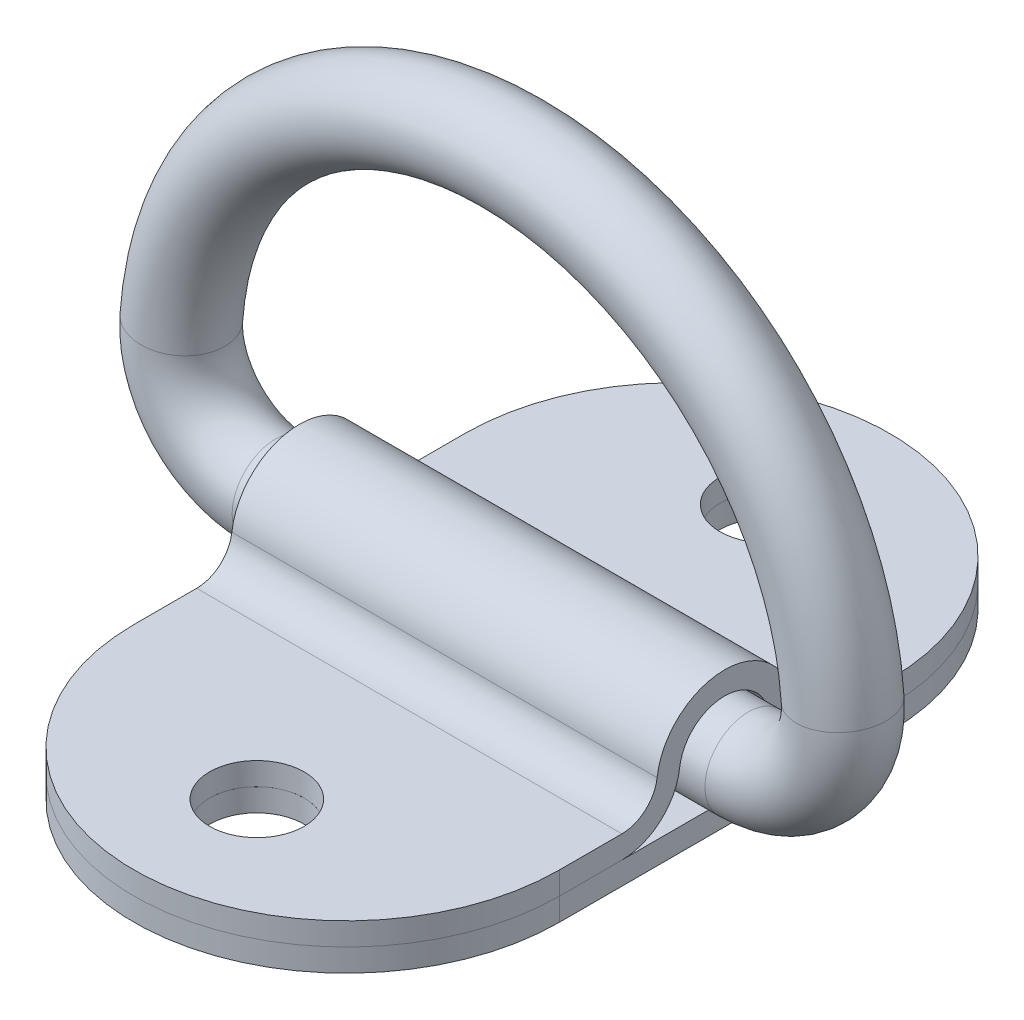
from build123d import *

# Parameters (mm, degrees)
BOSS_EXTRUDE1_DEPTH      = 14.2875
BOSS_EXTRUDE1_DEPTH_BACK = 14.2875
BOSS_EXTRUDE2_DEPTH      = 14.2875
BOSS_EXTRUDE2_DEPTH_BACK = 14.2875
SKETCH5_W                = 50.8
SKETCH5_H                = 1.524
SKETCH6_OUTSIDE_W        = 42.376
SKETCH6_OUTSIDE_H        = 64.6
CUT_EXTRUDE1_DEPTH       = 30.499082024
SKETCH7_R                = 3.175
CUT_EXTRUDE2_DEPTH       = 30.499082024
SKETCH8_R                = 2.921


with BuildPart() as part:
    # Sketch4 → Boss-Extrude1 (new, two sides: drawn at the far end of the back side and taken through both)
    with BuildSketch(Plane(origin=(0, 0, 0), x_dir=(0, 0, -1), z_dir=(1, 0, 0)).offset(-BOSS_EXTRUDE1_DEPTH_BACK)):
        with BuildLine():
            Line((-25.4, -3.048), (-6.900203475, -3.048))
            ThreePointArc((-6.900203475, -3.048), (-4.314597158, -2.069457627), (-3.024746729, 0.375780822))
            ThreePointArc((-3.024746729, 0.375780822), (0, 3.048), (3.024746729, 0.375780822))
            ThreePointArc((3.024746729, 0.375780822), (4.314597158, -2.069457627), (6.900203475, -3.048))
            Line((6.900203475, -3.048), (25.4, -3.048))
            Line((25.4, -3.048), (25.4, -1.524))
            Line((25.4, -1.524), (6.900203475, -1.524))
            ThreePointArc((6.900203475, -1.524), (5.323614257, -0.927327821), (4.537120093, 0.563671233))
            ThreePointArc((4.537120093, 0.563671233), (0, 4.572), (-4.537120093, 0.563671233))
            ThreePointArc((-4.537120093, 0.563671233), (-5.323614257, -0.927327821), (-6.900203475, -1.524))
            Line((-6.900203475, -1.524), (-25.4, -1.524))
            Line((-25.4, -1.524), (-25.4, -3.048))
        make_face()
    extrude(amount=BOSS_EXTRUDE1_DEPTH + BOSS_EXTRUDE1_DEPTH_BACK)


with BuildPart() as body_2:
    # Sketch5 → Boss-Extrude2 (new, two sides: drawn at the far end of the back side and taken through both)
    with BuildSketch(Plane(origin=(0, 0, 0), x_dir=(0, 0, -1), z_dir=(1, 0, 0)).offset(-BOSS_EXTRUDE2_DEPTH_BACK)):
        with Locations((0, -3.81)):
            Rectangle(SKETCH5_W, SKETCH5_H)
    extrude(amount=BOSS_EXTRUDE2_DEPTH + BOSS_EXTRUDE2_DEPTH_BACK)


with BuildPart() as cut_extrude1_tool:
    # Sketch6 outside → Cut-Extrude1 (new, through all)
    with BuildSketch(Plane(origin=(0, 0, 0), x_dir=(1, 0, 0), z_dir=(0, 1, 0))):
        Rectangle(SKETCH6_OUTSIDE_W, SKETCH6_OUTSIDE_H)
        with BuildLine():
            Line((-14.2875, -11.1125), (-14.2875, 11.1125))
            ThreePointArc((-14.2875, 11.1125), (0, 25.4), (14.2875, 11.1125))
            Line((14.2875, 11.1125), (14.2875, -11.1125))
            ThreePointArc((14.2875, -11.1125), (0, -25.4), (-14.2875, -11.1125))
        make_face(mode=Mode.SUBTRACT)
    extrude(amount=-CUT_EXTRUDE1_DEPTH)


with BuildPart() as part_1:
    add(part.part)

    # Cut-Extrude1: cut by cut_extrude1_tool
    add(cut_extrude1_tool.part, mode=Mode.SUBTRACT)


with BuildPart() as body_2_1:
    add(body_2.part)

    # Cut-Extrude1: cut by cut_extrude1_tool
    add(cut_extrude1_tool.part, mode=Mode.SUBTRACT)


with BuildPart() as cut_extrude2_tool:
    # Sketch7 → Cut-Extrude2 (new, through all)
    with BuildSketch(Plane(origin=(0, 0, 0), x_dir=(1, 0, 0), z_dir=(0, 1, 0))):
        with Locations(Location((0, -17.145, 0), (0, 0, 270))):
            Circle(SKETCH7_R)
        with Locations(Location((0, 17.145, 0), (0, 0, 270))):
            Circle(SKETCH7_R)
    extrude(amount=-CUT_EXTRUDE2_DEPTH)


with BuildPart() as part_2:
    add(part_1.part)

    # Cut-Extrude2: cut by cut_extrude2_tool
    add(cut_extrude2_tool.part, mode=Mode.SUBTRACT)


with BuildPart() as body_2_2:
    add(body_2_1.part)

    # Cut-Extrude2: cut by cut_extrude2_tool
    add(cut_extrude2_tool.part, mode=Mode.SUBTRACT)


with BuildPart() as body_3:
    # Sweep1: sweep along a path in Sketch9
    with BuildLine(Plane.XY) as sweep1_path:
        Line((-15.883616212, 0), (15.883616212, 0))
        ThreePointArc((15.883616212, 0), (20.530076972, 2.021847692), (22.217660264, 6.799873258))
        ThreePointArc((22.217660264, 6.799873258), (0, 27.4955), (-22.217660264, 6.799873258))
        ThreePointArc((-22.217660264, 6.799873258), (-20.530076972, 2.021847692), (-15.883616212, 0))
    # Sketch8 → Sweep1 (sweep)
    with BuildSketch(Plane(origin=(0, 0, 0), x_dir=(0, 0, -1), z_dir=(1, 0, 0))):
        Circle(SKETCH8_R)
    sweep(path=sweep1_path.line)


solid = Compound([part_2.part, body_2_2.part, body_3.part])
